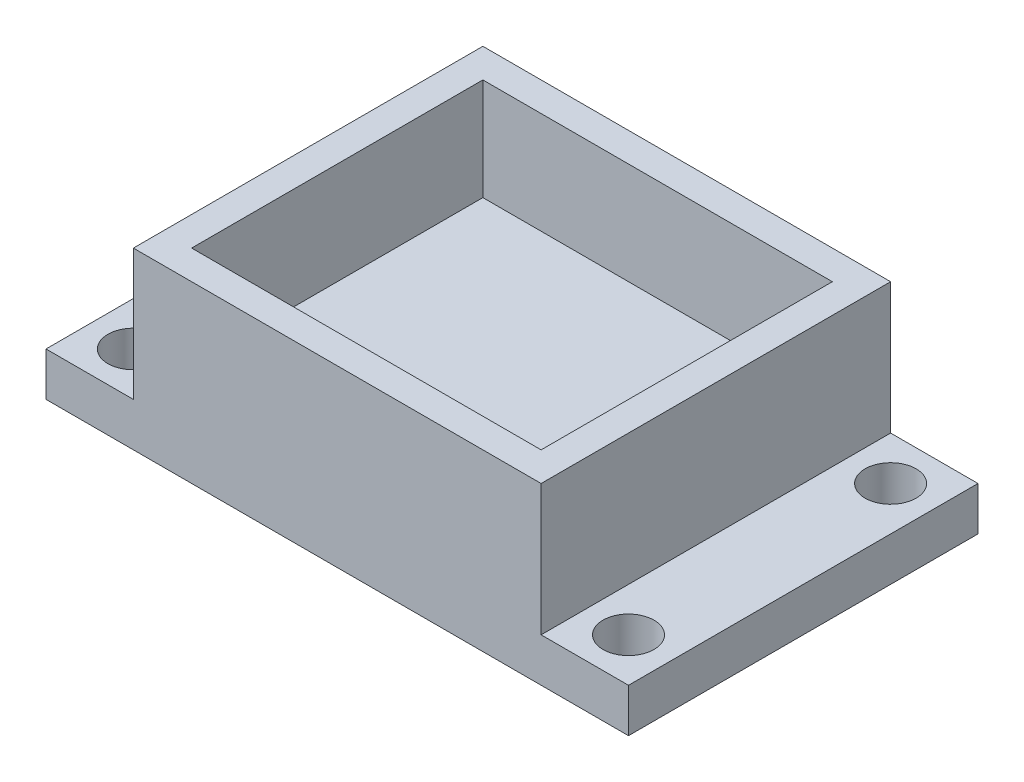
from build123d import *

# Parameters (mm, degrees)
SKETCH_1_W          = 28
SKETCH_1_H          = 24
EXTRUDE_2_DEPTH     = 12
SKETCH_2_W          = 24
SKETCH_2_H          = 20
CUT_EXTRUDE_1_DEPTH = 7
SKETCH_3_W          = 24
SKETCH_3_H          = 3
EXTRUDE_4_DEPTH     = 6
HOLE_WIZARD_1_D     = 3.5
HOLE_WIZARD_2_D     = 2.3
SKETCH_10_W         = 2.5
SKETCH_10_H         = 7
CUT_EXTRUDE_2_DEPTH = 1
CUT_EXTRUDE_3_DEPTH = 3.2


with BuildPart() as part:
    # 草图1 → 凸台-拉伸2 (new body)
    with BuildSketch(Plane(origin=(0, 0, 0), x_dir=(1, 0, 0), z_dir=(0, 1, 0))):
        Rectangle(SKETCH_1_W, SKETCH_1_H)
    extrude(amount=EXTRUDE_2_DEPTH)

    # 草图2 → 切除-拉伸1 (cut)
    with BuildSketch(Plane(origin=(0, 12, 0), x_dir=(1, 0, 0), z_dir=(0, 1, 0))):
        Rectangle(SKETCH_2_W, SKETCH_2_H)
    extrude(amount=-CUT_EXTRUDE_1_DEPTH, mode=Mode.SUBTRACT)

    # 草图3 → 凸台-拉伸4 (add)
    with BuildSketch(Plane.ZY.offset(14)):
        with Locations((0, 1.5)):
            Rectangle(SKETCH_3_W, SKETCH_3_H)
    extrude_4 = extrude(amount=EXTRUDE_4_DEPTH)

    # 孔1 (through all)
    with Locations(Plane(origin=(0, 3, 0), x_dir=(1, 0, 0), z_dir=(0, 1, 0))):
        with Locations((-17, 9), (-17, -9)):
            hole_wizard_1 = Hole(HOLE_WIZARD_1_D / 2)

    # 镜向1: 凸台-拉伸4, 孔1 across plane
    add(extrude_4.mirror(Plane.ZY))
    add(hole_wizard_1.mirror(Plane.ZY), mode=Mode.SUBTRACT)

    # 孔2 (through all)
    with Locations(Plane(origin=(0, 5, 0), x_dir=(1, 0, 0), z_dir=(0, 1, 0))):
        with Locations((9.5, 7.5), (9.5, -7.5)):
            Hole(HOLE_WIZARD_2_D / 2)

    # 草图10 → 切除-拉伸2 (cut)
    with BuildSketch(Plane(origin=(0, 5, 0), x_dir=(1, 0, 0), z_dir=(0, 1, 0))):
        with Locations((10.75, 0)):
            Rectangle(SKETCH_10_W, SKETCH_10_H)
    extrude(amount=-CUT_EXTRUDE_2_DEPTH, mode=Mode.SUBTRACT)

    # 草图11 → 切除-拉伸3 (cut)
    with BuildSketch(Plane(origin=(0, 0, 0), x_dir=(-1, 0, 0), z_dir=(0, -1, 0))):
        Polygon((-11.924871131, -7.5), (-10.712435565, -9.6), (-8.287564435, -9.6), (-7.075128869, -7.5), (-8.287564435, -5.4), (-10.712435565, -5.4), align=None)
        Polygon((-11.924871131, 7.5), (-10.712435565, 5.4), (-8.287564435, 5.4), (-7.075128869, 7.5), (-8.287564435, 9.6), (-10.712435565, 9.6), align=None)
    extrude(amount=-CUT_EXTRUDE_3_DEPTH, mode=Mode.SUBTRACT)


solid = part.part
